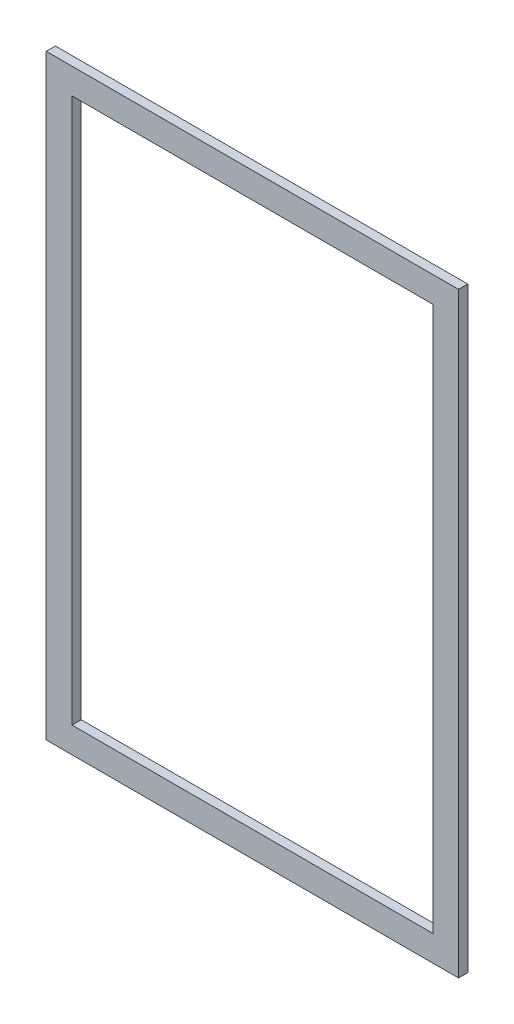
from build123d import *

# Parameters (mm, degrees)
SKETCH1_W     = 224
SKETCH1_H     = 324
SKETCH1_W_2   = 196
SKETCH1_H_2   = 296
PROFILE_DEPTH = 5


with BuildPart() as part:
    # Sketch1 → Profile (new body)
    with BuildSketch(Plane.XY):
        with Locations((112, 162)):
            Rectangle(SKETCH1_W, SKETCH1_H)
        with Locations((112, 162)):
            Rectangle(SKETCH1_W_2, SKETCH1_H_2, mode=Mode.SUBTRACT)
    extrude(amount=PROFILE_DEPTH)


solid = part.part
